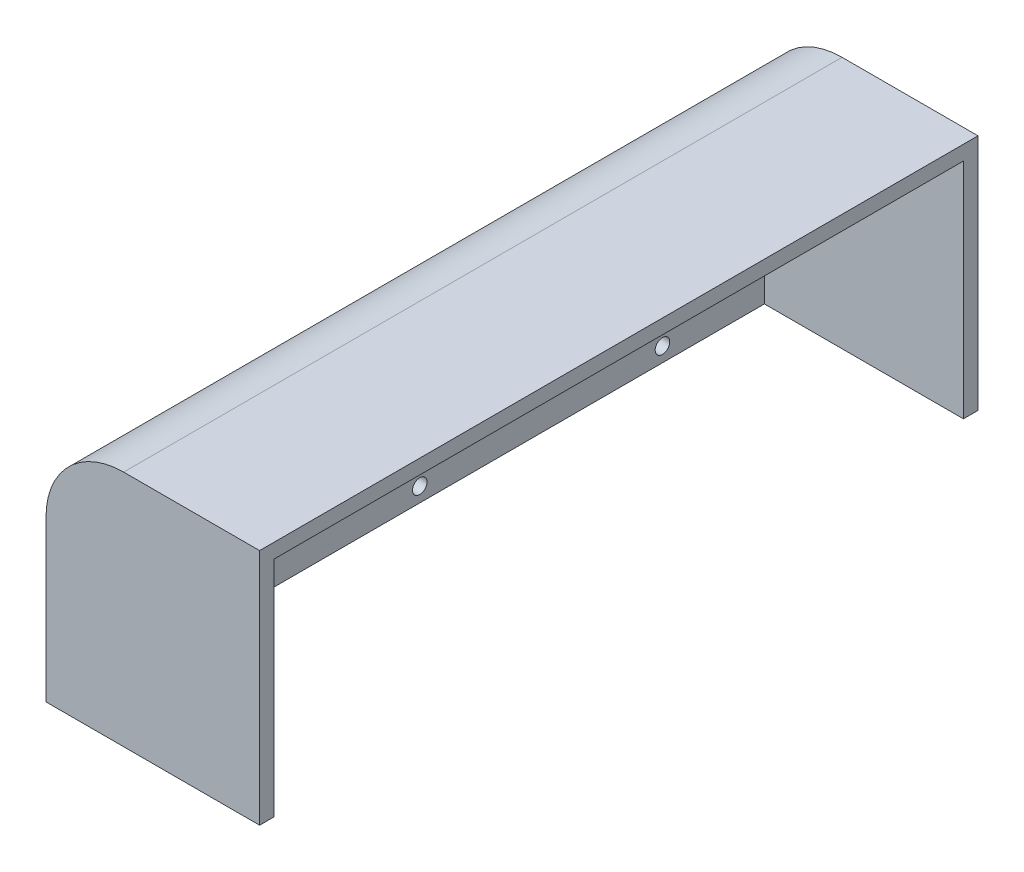
from build123d import *

# Parameters (mm, degrees)
BOSS_EXTRUDE1_DEPTH     = 23
SKETCH3_W               = 22
SKETCH3_H               = 74
BOSS_EXTRUDE2_DEPTH     = 1.5
FILLET1_R               = 8
CUT_EXTRUDE1_DEPTH      = 50.53029376
CUT_EXTRUDE1_DEPTH_BACK = 50.53029376
SKETCH4_R               = 0.75


with BuildPart() as part:
    # Sketch2 → Boss-Extrude1 (new body)
    with BuildSketch(Plane(origin=(0, 0, 0), x_dir=(1, 0, 0), z_dir=(0, 1, 0))):
        Polygon((-10.5, -35.5), (10, -35.5), (10, -37), (-12, -37), (-12, 37), (10, 37), (10, 35.5), (-10.5, 35.5), align=None)
    extrude(amount=BOSS_EXTRUDE1_DEPTH)

    # Sketch3 → Boss-Extrude2 (add)
    with BuildSketch(Plane(origin=(0, 23, 0), x_dir=(1, 0, 0), z_dir=(0, 1, 0))):
        with Locations((-1, 0)):
            Rectangle(SKETCH3_W, SKETCH3_H)
    extrude(amount=BOSS_EXTRUDE2_DEPTH)

    # Fillet1
    fillet1_edges = [part.edges().sort_by_distance(p)[0] for p in [
        (-12, 24.5, 0),
        (-10.5, 23, 0),
    ]]
    fillet(fillet1_edges, radius=FILLET1_R)

    # Sketch4 → Cut-Extrude1 (cut, two sides: drawn at the far end of the back side and taken through both)
    with BuildSketch(Plane.ZY.offset(12).offset(-CUT_EXTRUDE1_DEPTH_BACK)):
        with Locations((-25, 1.5)):
            Circle(SKETCH4_R)
        with Locations((0, 1.5)):
            Circle(SKETCH4_R)
        with Locations((25, 1.5)):
            Circle(SKETCH4_R)
    extrude(amount=CUT_EXTRUDE1_DEPTH + CUT_EXTRUDE1_DEPTH_BACK, mode=Mode.SUBTRACT)


solid = part.part
